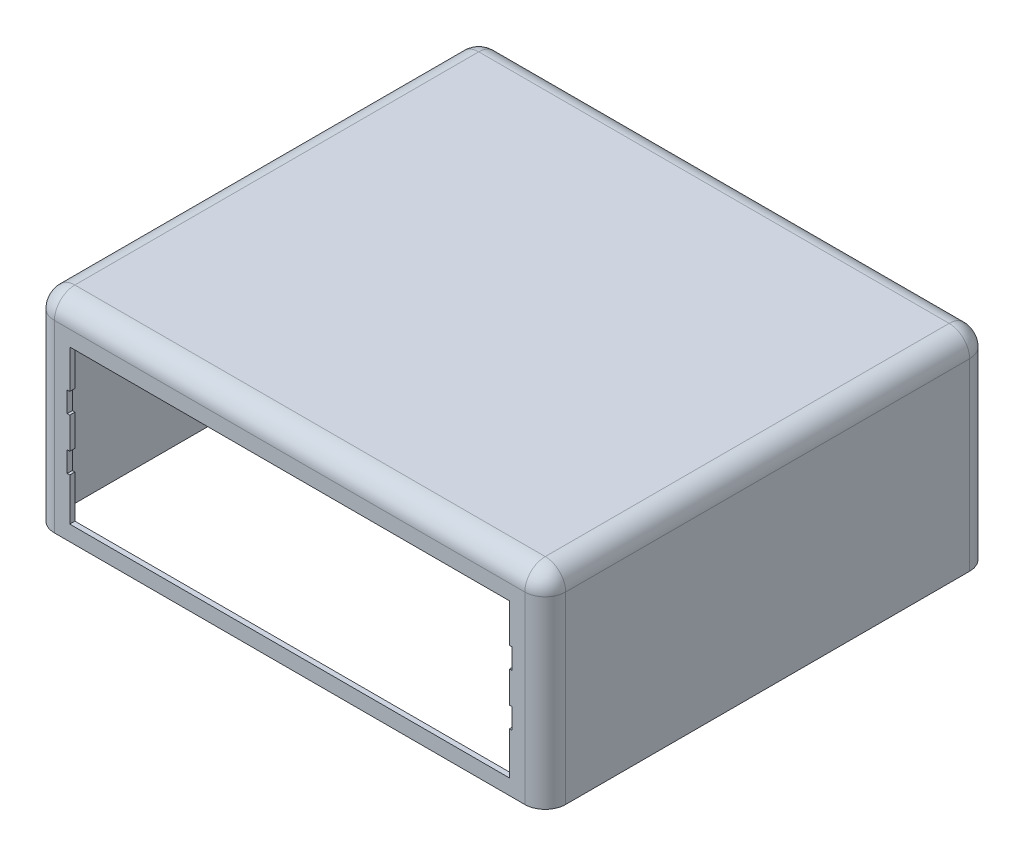
from build123d import *

# Parameters (mm, degrees)
SKETCH1_W           = 2540
SKETCH1_H           = 2209.8
BOSS_EXTRUDE1_DEPTH = 1016
FILLET1_R           = 101.6
SHELL1_T            = -25.4
SKETCH2_W           = 2184.4
SKETCH2_H           = 762
CUT_EXTRUDE1_DEPTH  = 101.6
CUT_EXTRUDE2_DEPTH  = 25.4


with BuildPart() as part:
    # Sketch1 → Boss-Extrude1 (new body)
    with BuildSketch(Plane(origin=(0, 0, 0), x_dir=(1, 0, 0), z_dir=(0, 1, 0))):
        Rectangle(SKETCH1_W, SKETCH1_H)
    extrude(amount=BOSS_EXTRUDE1_DEPTH)

    # Fillet1
    fillet1_edges = [part.edges().sort_by_distance(p)[0] for p in [
        (-1270, 1016, 0),
        (0, 1016, 1104.9),
        (1270, 1016, 0),
        (1270, 508, 1104.9),
        (-1270, 508, 1104.9),
        (-1270, 508, -1104.9),
        (1270, 508, -1104.9),
        (0, 1016, -1104.9),
    ]]
    fillet(fillet1_edges, radius=FILLET1_R)

    # Shell1
    shell1_openings = [part.faces().sort_by_distance(p)[0] for p in [
        (0, 0, 0),
    ]]
    offset(amount=SHELL1_T, openings=shell1_openings, kind=Kind.INTERSECTION)

    # Sketch2 → Cut-Extrude1 (cut)
    with BuildSketch(Plane.XY.offset(1104.9)):
        with Locations((0, 457.2)):
            Rectangle(SKETCH2_W, SKETCH2_H)
    extrude(amount=-CUT_EXTRUDE1_DEPTH, mode=Mode.SUBTRACT)

    # Sketch4 → Cut-Extrude2 (cut)
    with BuildSketch(Plane.XY.offset(1104.9)):
        Polygon((-1092.2, 338.556587626), (-1092.2, 389.356587626), (-1104.9, 389.356587626), (-1104.9, 287.756587626), (-1092.2, 287.756587626), align=None)
        Polygon((1104.9, 646.867286995), (1092.2, 646.867286995), (1092.2, 596.067286995), (1092.2, 545.267286995), (1104.9, 545.267286995), align=None)
        Polygon((1104.9, 389.356587626), (1092.2, 389.356587626), (1092.2, 338.556587626), (1092.2, 287.756587626), (1104.9, 287.756587626), align=None)
        Polygon((-1092.2, 596.067286995), (-1092.2, 545.267286995), (-1104.9, 545.267286995), (-1104.9, 646.867286995), (-1092.2, 646.867286995), align=None)
    extrude(amount=-CUT_EXTRUDE2_DEPTH, mode=Mode.SUBTRACT)


solid = part.part
